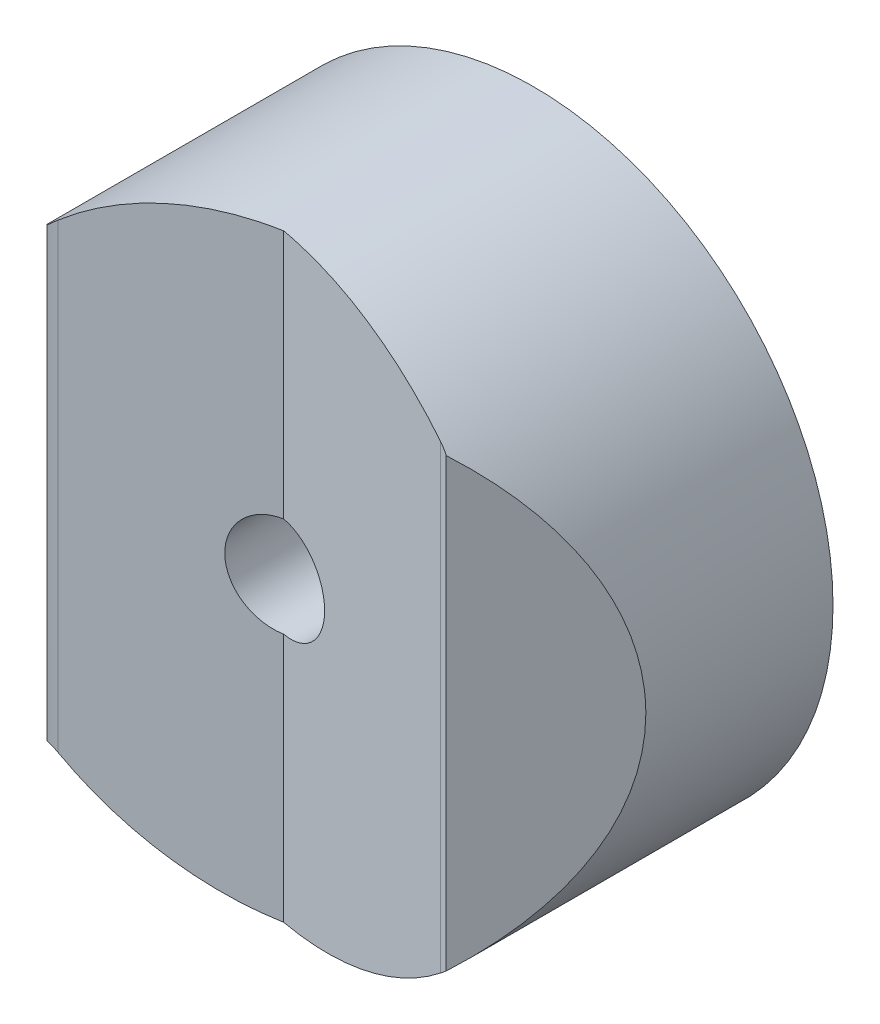
from build123d import *

# Parameters (mm, degrees)
SKETCH1_R               = 38.1
SKETCH1_R_2             = 6.35
BOSS_EXTRUDE1_DEPTH     = 36.5125
CUT_EXTRUDE2_DEPTH      = 66.0875
CUT_EXTRUDE2_DEPTH_BACK = 66.0875


with BuildPart() as part:
    # Sketch1 → Boss-Extrude1 (new body)
    with BuildSketch(Plane.XY):
        Circle(SKETCH1_R)
        Circle(SKETCH1_R_2, mode=Mode.SUBTRACT)
    extrude(amount=-BOSS_EXTRUDE1_DEPTH)

    # Sketch2 → Cut-Extrude2 (cut, two sides: drawn at the far end of the back side and taken through both)
    with BuildSketch(Plane(origin=(0, 0, 0), x_dir=(1, 0, 0), z_dir=(0, 1, 0)).offset(-CUT_EXTRUDE2_DEPTH_BACK)):
        Polygon((-38.1, 12.7), (-38.1, 0), (-25.4, 0), align=None)
        with BuildLine():
            Line((0, 0), (0, 4.7244))
            Line((0, 4.7244), (-24.339821656, 0.316401004))
            ThreePointArc((-24.339821656, 0.316401004), (-24.878689325, 0.187614988), (-25.4, 0))
            Line((-25.4, 0), (0, 0))
        make_face()
        with BuildLine():
            Line((24.339821656, 0.316401004), (0, 4.7244))
            Line((0, 4.7244), (0, 0))
            Line((0, 0), (25.4, 0))
            ThreePointArc((25.4, 0), (24.878689325, 0.187614988), (24.339821656, 0.316401004))
        make_face()
        Polygon((38.1, 12.7), (38.1, 0), (25.4, 0), align=None)
    extrude(amount=CUT_EXTRUDE2_DEPTH + CUT_EXTRUDE2_DEPTH_BACK, mode=Mode.SUBTRACT)


solid = part.part
